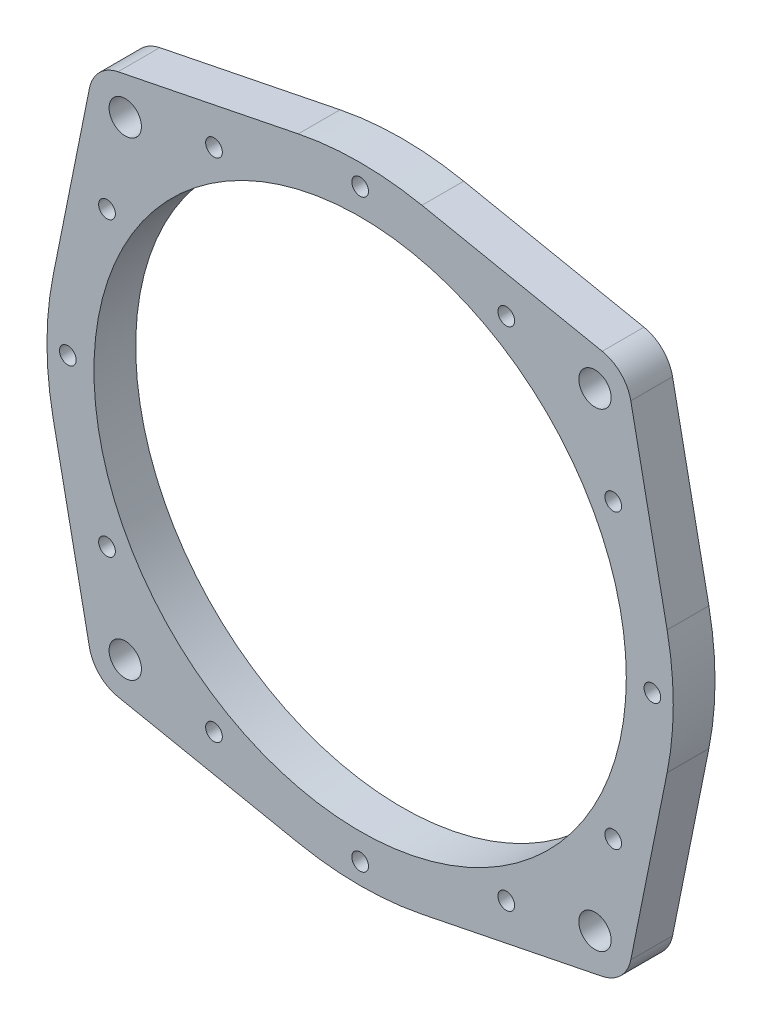
from build123d import *

# Parameters (mm, degrees)
SKETCH_1_R          = 3.1
SKETCH_1_R_2        = 1.6
SKETCH_1_R_3        = 51
EXTRUDE_1_DEPTH     = 8
SKETCH_2_R          = 2.6
CUT_EXTRUDE_1_DEPTH = 4


with BuildPart() as part:
    # 草图1 → 凸台-拉伸1 (new body)
    with BuildSketch(Plane.XY):
        with BuildLine():
            Line((-51.862164548, 46.382279896), (-58.818553272, 11.848113395))
            ThreePointArc((-58.818553272, 11.848113395), (-60, 0), (-58.818553272, -11.848113395))
            Line((-58.818553272, -11.848113395), (-51.862164548, -46.382279896))
            ThreePointArc((-51.862164548, -46.382279896), (-49.949747468, -49.949747468), (-46.382279896, -51.862164548))
            Line((-46.382279896, -51.862164548), (-11.848113395, -58.818553272))
            ThreePointArc((-11.848113395, -58.818553272), (0, -60), (11.848113395, -58.818553272))
            Line((11.848113395, -58.818553272), (46.382279896, -51.862164548))
            ThreePointArc((46.382279896, -51.862164548), (49.949747468, -49.949747468), (51.862164548, -46.382279896))
            Line((51.862164548, -46.382279896), (58.818553272, -11.848113395))
            ThreePointArc((58.818553272, -11.848113395), (60, 0), (58.818553272, 11.848113395))
            Line((58.818553272, 11.848113395), (51.862164548, 46.382279896))
            ThreePointArc((51.862164548, 46.382279896), (49.949747468, 49.949747468), (46.382279896, 51.862164548))
            Line((46.382279896, 51.862164548), (11.848113395, 58.818553272))
            ThreePointArc((11.848113395, 58.818553272), (0, 60), (-11.848113395, 58.818553272))
            Line((-11.848113395, 58.818553272), (-46.382279896, 51.862164548))
            ThreePointArc((-46.382279896, 51.862164548), (-49.949747468, 49.949747468), (-51.862164548, 46.382279896))
        make_face()
        with Locations((45, 45)):
            Circle(SKETCH_1_R, mode=Mode.SUBTRACT)
        with Locations((-45, 45)):
            Circle(SKETCH_1_R, mode=Mode.SUBTRACT)
        with Locations((-45, -45)):
            Circle(SKETCH_1_R, mode=Mode.SUBTRACT)
        with Locations((45, -45)):
            Circle(SKETCH_1_R, mode=Mode.SUBTRACT)
        with Locations((0, 56)):
            Circle(SKETCH_1_R_2, mode=Mode.SUBTRACT)
        with Locations((28, 48.497422612)):
            Circle(SKETCH_1_R_2, mode=Mode.SUBTRACT)
        with Locations((48.497422612, 28)):
            Circle(SKETCH_1_R_2, mode=Mode.SUBTRACT)
        with Locations((56, 0)):
            Circle(SKETCH_1_R_2, mode=Mode.SUBTRACT)
        with Locations((48.497422612, -28)):
            Circle(SKETCH_1_R_2, mode=Mode.SUBTRACT)
        with Locations((28, -48.497422612)):
            Circle(SKETCH_1_R_2, mode=Mode.SUBTRACT)
        with Locations((0, -56)):
            Circle(SKETCH_1_R_2, mode=Mode.SUBTRACT)
        with Locations((-28, -48.497422612)):
            Circle(SKETCH_1_R_2, mode=Mode.SUBTRACT)
        with Locations((-48.497422612, -28)):
            Circle(SKETCH_1_R_2, mode=Mode.SUBTRACT)
        with Locations((-56, 0)):
            Circle(SKETCH_1_R_2, mode=Mode.SUBTRACT)
        with Locations((-48.497422612, 28)):
            Circle(SKETCH_1_R_2, mode=Mode.SUBTRACT)
        with Locations((-28, 48.497422612)):
            Circle(SKETCH_1_R_2, mode=Mode.SUBTRACT)
        Circle(SKETCH_1_R_3, mode=Mode.SUBTRACT)
    extrude(amount=EXTRUDE_1_DEPTH)

    # 草图2 → 切除-拉伸1 (cut)
    with BuildSketch(Plane(origin=(0, 0, 0), x_dir=(-1, 0, 0), z_dir=(0, 0, -1))):
        with Locations((-28, 48.497422612)):
            Circle(SKETCH_2_R)
        with Locations((0, 56)):
            Circle(SKETCH_2_R)
        with Locations((28, 48.497422612)):
            Circle(SKETCH_2_R)
        with Locations((48.497422612, 28)):
            Circle(SKETCH_2_R)
        with Locations((56, 0)):
            Circle(SKETCH_2_R)
        with Locations((48.497422612, -28)):
            Circle(SKETCH_2_R)
        with Locations((28, -48.497422612)):
            Circle(SKETCH_2_R)
        with Locations((0, -56)):
            Circle(SKETCH_2_R)
        with Locations((-28, -48.497422612)):
            Circle(SKETCH_2_R)
        with Locations((-48.497422612, -28)):
            Circle(SKETCH_2_R)
        with Locations((-56, 0)):
            Circle(SKETCH_2_R)
        with Locations((-48.497422612, 28)):
            Circle(SKETCH_2_R)
    extrude(amount=-CUT_EXTRUDE_1_DEPTH, mode=Mode.SUBTRACT)


solid = part.part
